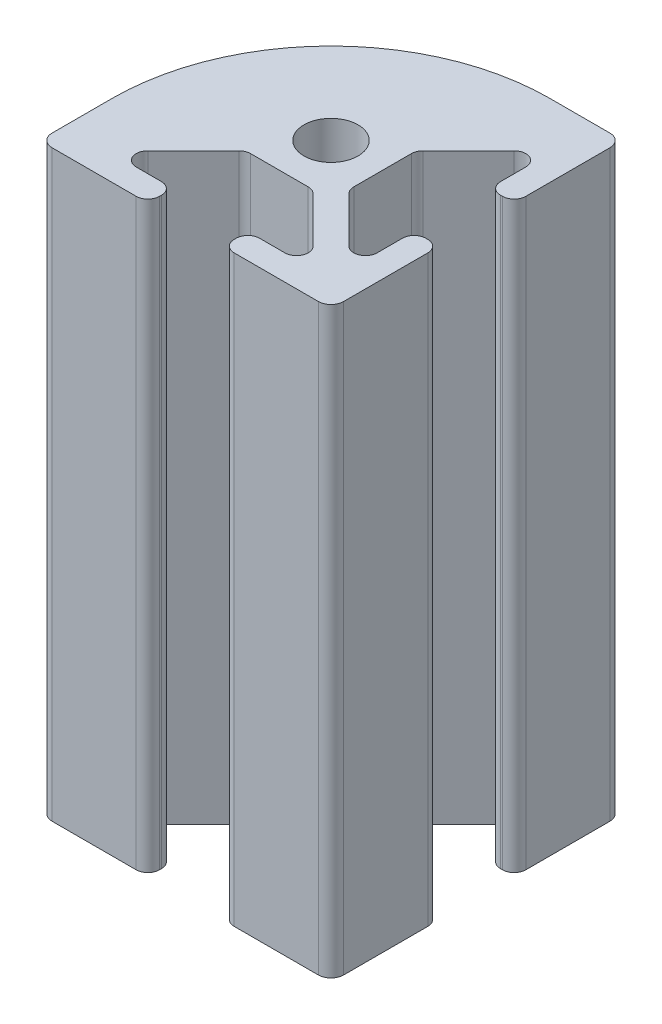
from build123d import *

# Parameters (mm, degrees)
SKETCH11_R               = 2.354570308
MEMBER_10_1012_S_1_DEPTH = 50.8


with BuildPart() as part:
    # Sketch11 → Member 10 1012-S_1 (new body)
    with BuildSketch(Plane(origin=(0, 0, 0), x_dir=(-1, 0, 0), z_dir=(0, 1, 0))):
        with BuildLine():
            Line((24.2951, 0), (16.9672, 0))
            ThreePointArc((16.9672, 0), (16.24877951, -0.29757951), (15.9512, -1.016))
            Line((15.9512, -1.016), (15.9512, -1.1938))
            ThreePointArc((15.9512, -1.1938), (16.24877951, -1.91222049), (16.9672, -2.2098))
            Line((16.9672, -2.2098), (19.174794456, -2.2098))
            ThreePointArc((19.174794456, -2.2098), (20.113456061, -2.836993633), (19.893214945, -3.94422049))
            Line((19.893214945, -3.94422049), (15.930814945, -7.90662049))
            ThreePointArc((15.930814945, -7.90662049), (15.601200823, -8.126861605), (15.212394456, -8.2042))
            Line((15.212394456, -8.2042), (10.187605544, -8.2042))
            ThreePointArc((10.187605544, -8.2042), (9.798799177, -8.126861605), (9.469185055, -7.90662049))
            Line((9.469185055, -7.90662049), (5.506785055, -3.94422049))
            ThreePointArc((5.506785055, -3.94422049), (5.286543939, -2.836993633), (6.225205544, -2.2098))
            Line((6.225205544, -2.2098), (8.4328, -2.2098))
            ThreePointArc((8.4328, -2.2098), (9.15122049, -1.91222049), (9.4488, -1.1938))
            Line((9.4488, -1.1938), (9.4488, -1.016))
            ThreePointArc((9.4488, -1.016), (9.15122049, -0.29757951), (8.4328, 0))
            Line((8.4328, 0), (1.1049, 0))
            ThreePointArc((1.1049, 0), (0.323617717, -0.323617717), (0, -1.1049))
            Line((0, -1.1049), (0, -8.4328))
            ThreePointArc((0, -8.4328), (0.29757951, -9.15122049), (1.016, -9.4488))
            Line((1.016, -9.4488), (1.1938, -9.4488))
            ThreePointArc((1.1938, -9.4488), (1.91222049, -9.15122049), (2.2098, -8.4328))
            Line((2.2098, -8.4328), (2.2098, -6.225205544))
            ThreePointArc((2.2098, -6.225205544), (2.836993633, -5.286543939), (3.94422049, -5.506785055))
            Line((3.94422049, -5.506785055), (7.90662049, -9.469185055))
            ThreePointArc((7.90662049, -9.469185055), (8.126861605, -9.798799177), (8.2042, -10.187605544))
            Line((8.2042, -10.187605544), (8.2042, -15.212394456))
            ThreePointArc((8.2042, -15.212394456), (8.126861605, -15.601200823), (7.90662049, -15.930814945))
            Line((7.90662049, -15.930814945), (3.94422049, -19.893214945))
            ThreePointArc((3.94422049, -19.893214945), (2.836993633, -20.113456061), (2.2098, -19.174794456))
            Line((2.2098, -19.174794456), (2.2098, -16.9672))
            ThreePointArc((2.2098, -16.9672), (1.91222049, -16.24877951), (1.1938, -15.9512))
            Line((1.1938, -15.9512), (1.016, -15.9512))
            ThreePointArc((1.016, -15.9512), (0.29757951, -16.24877951), (0, -16.9672))
            Line((0, -16.9672), (0, -24.2951))
            ThreePointArc((0, -24.2951), (0.323617717, -25.076382283), (1.1049, -25.4))
            Line((1.1049, -25.4), (6.35, -25.4))
            ThreePointArc((6.35, -25.4), (19.820384182, -19.820384182), (25.4, -6.35))
            Line((25.4, -6.35), (25.4, -1.1049))
            ThreePointArc((25.4, -1.1049), (25.076382283, -0.323617717), (24.2951, 0))
        make_face()
        with Locations((12.7, -12.7)):
            Circle(SKETCH11_R, mode=Mode.SUBTRACT)
    extrude(amount=MEMBER_10_1012_S_1_DEPTH)


solid = part.part
